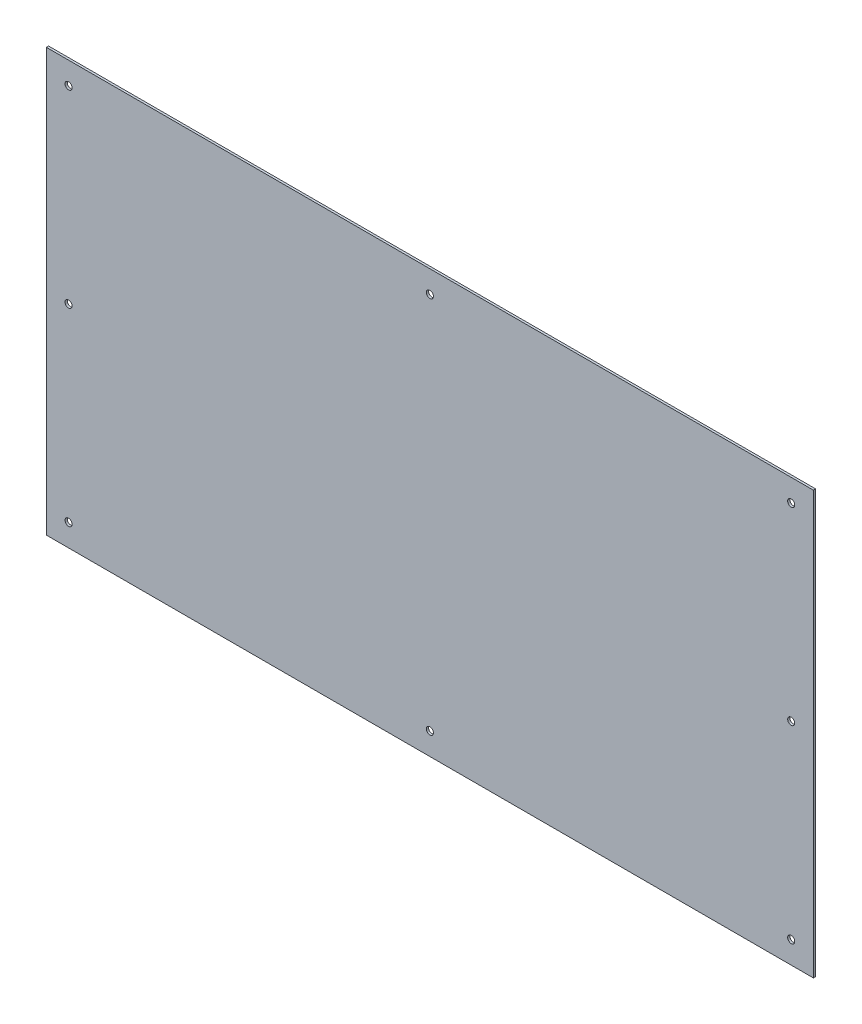
from build123d import *

# Parameters (mm, degrees)
CROQUIS1_W              = 690
CROQUIS1_H              = 380
SALIENTE_EXTRUIR1_DEPTH = 2
CROQUIS2_R              = 3.175
CORTAR_EXTRUIR2_DEPTH   = 10


with BuildPart() as part:
    # Croquis1 → Saliente-Extruir1 (new body)
    with BuildSketch(Plane.XY):
        with Locations((-67, 3)):
            Rectangle(CROQUIS1_W, CROQUIS1_H)
    extrude(amount=SALIENTE_EXTRUIR1_DEPTH)

    # Croquis2 → Cortar-Extruir2 (cut)
    with BuildSketch(Plane.XY.offset(2)):
        with Locations((-392, 173)):
            Circle(CROQUIS2_R)
        with Locations(Location((258, 173, 0), (0, 0, 180))):
            Circle(CROQUIS2_R)
        with Locations((258, -167)):
            Circle(CROQUIS2_R)
        with Locations(Location((-392, -167, 0), (0, 0, 180))):
            Circle(CROQUIS2_R)
        with Locations((-392, 3)):
            Circle(CROQUIS2_R)
        with Locations(Location((258, 3, 0), (0, 0, 180))):
            Circle(CROQUIS2_R)
        with Locations((-67, 173)):
            Circle(CROQUIS2_R)
        with Locations(Location((-67, -167, 0), (0, 0, 180))):
            Circle(CROQUIS2_R)
    extrude(amount=-CORTAR_EXTRUIR2_DEPTH, mode=Mode.SUBTRACT)


solid = part.part
